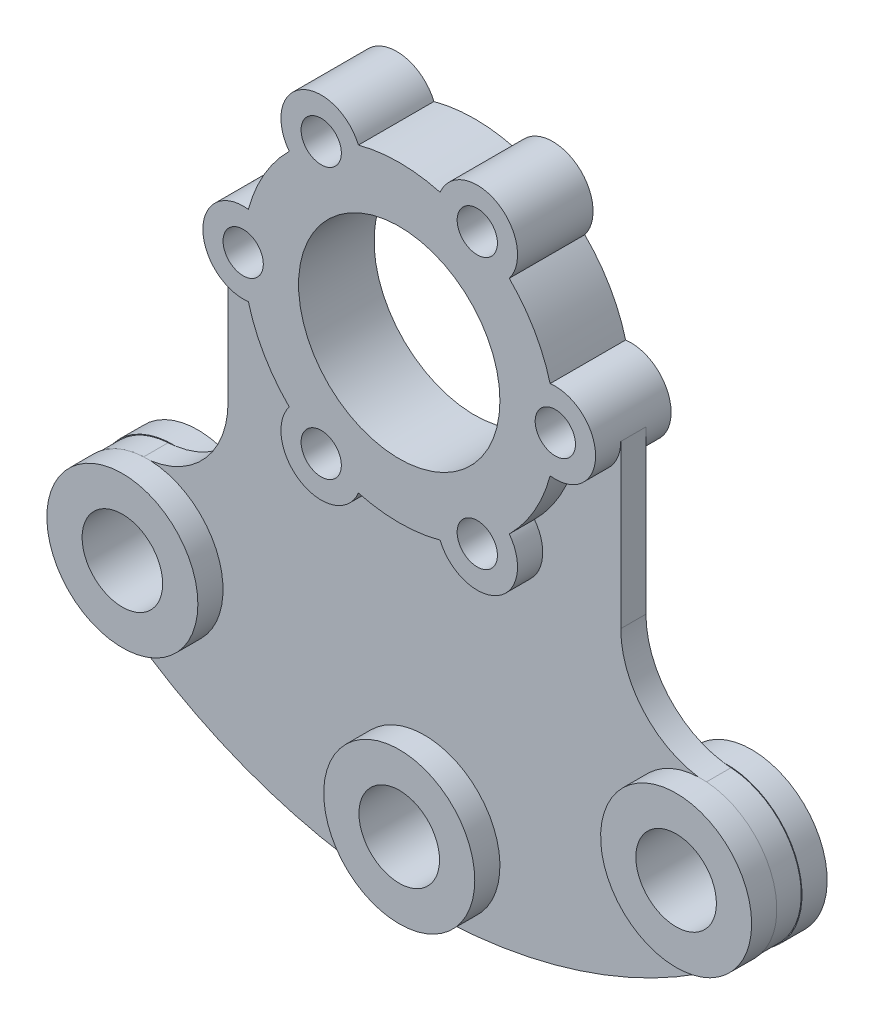
from build123d import *
from build123d.topology import SkipClean

# Parameters (mm, degrees)
SKETCH1_R           = 20
SKETCH1_R_2         = 4
BOSS_EXTRUDE1_DEPTH = 15
SKETCH3_R           = 8
BOSS_EXTRUDE2_DEPTH = 2.5
SKETCH4_R           = 15
SKETCH4_R_2         = 8
BOSS_EXTRUDE3_DEPTH = 5
BOSS_EXTRUDE4_START = 5
SKETCH5_R           = 15
SKETCH5_R_2         = 8
BOSS_EXTRUDE4_DEPTH = 5


with BuildPart() as part:
    # Sketch1 → Boss-Extrude1 (new body)
    with BuildSketch(Plane.XY):
        with BuildLine():
            ThreePointArc((-21.854157167, 21.986264223), (-26.846787517, 15.5), (-29.967741935, 7.933123174))
            ThreePointArc((-29.967741935, 7.933123174), (-39, 0), (-29.967741935, -7.933123174))
            ThreePointArc((-29.967741935, -7.933123174), (-26.846787517, -15.5), (-21.854157167, -21.986264223))
            ThreePointArc((-21.854157167, -21.986264223), (-19.5, -33.774990748), (-8.113584768, -29.919387397))
            ThreePointArc((-8.113584768, -29.919387397), (0, -31), (8.113584768, -29.919387397))
            ThreePointArc((8.113584768, -29.919387397), (19.5, -33.774990748), (21.854157167, -21.986264223))
            ThreePointArc((21.854157167, -21.986264223), (26.846787517, -15.5), (29.967741935, -7.933123174))
            ThreePointArc((29.967741935, -7.933123174), (39, 0), (29.967741935, 7.933123174))
            ThreePointArc((29.967741935, 7.933123174), (26.846787517, 15.5), (21.854157167, 21.986264223))
            ThreePointArc((21.854157167, 21.986264223), (19.5, 33.774990748), (8.113584768, 29.919387397))
            ThreePointArc((8.113584768, 29.919387397), (0, 31), (-8.113584768, 29.919387397))
            ThreePointArc((-8.113584768, 29.919387397), (-19.5, 33.774990748), (-21.854157167, 21.986264223))
        make_face()
        Circle(SKETCH1_R, mode=Mode.SUBTRACT)
        with Locations((31, 0)):
            Circle(SKETCH1_R_2, mode=Mode.SUBTRACT)
        with Locations((15.5, -26.846787517)):
            Circle(SKETCH1_R_2, mode=Mode.SUBTRACT)
        with Locations((-15.5, -26.846787517)):
            Circle(SKETCH1_R_2, mode=Mode.SUBTRACT)
        with Locations((-31, 0)):
            Circle(SKETCH1_R_2, mode=Mode.SUBTRACT)
        with Locations((-15.5, 26.846787517)):
            Circle(SKETCH1_R_2, mode=Mode.SUBTRACT)
        with Locations((15.5, 26.846787517)):
            Circle(SKETCH1_R_2, mode=Mode.SUBTRACT)
    extrude(amount=-BOSS_EXTRUDE1_DEPTH)

    # Sketch3 → Boss-Extrude2 (add, symmetric)
    with BuildSketch(Plane.XY.offset(-7.5)):
        with BuildLine():
            Line((39, -32.207865452), (39, 0))
            ThreePointArc((39, 0), (36.279296141, -6.01074307), (29.967741935, -7.933123174))
            ThreePointArc((29.967741935, -7.933123174), (26.846787517, -15.5), (21.854157167, -21.986264223))
            ThreePointArc((21.854157167, -21.986264223), (19.5, -33.774990748), (8.113584768, -29.919387397))
            ThreePointArc((8.113584768, -29.919387397), (0, -31), (-8.113584768, -29.919387397))
            ThreePointArc((-8.113584768, -29.919387397), (-19.5, -33.774990748), (-21.854157167, -21.986264223))
            ThreePointArc((-21.854157167, -21.986264223), (-26.846787517, -15.5), (-29.967741935, -7.933123174))
            ThreePointArc((-29.967741935, -7.933123174), (-36.279296141, -6.01074307), (-39, 0))
            Line((-39, 0), (-39, -32.207865452))
            ThreePointArc((-39, -32.207865452), (-43.890381677, -44.542285074), (-55.904211935, -50.174480284))
            ThreePointArc((-55.904211935, -50.174480284), (-69.095919746, -60.318260945), (-64.594224147, -76.338628537))
            ThreePointArc((-64.594224147, -76.338628537), (0, -100), (64.594224147, -76.338628537))
            ThreePointArc((64.594224147, -76.338628537), (69.095919746, -60.318260945), (55.904211935, -50.174480284))
            ThreePointArc((55.904211935, -50.174480284), (43.890381677, -44.542285074), (39, -32.207865452))
        make_face()
        with Locations((0, -85)):
            Circle(SKETCH3_R, mode=Mode.SUBTRACT)
        with Locations((55, -65)):
            Circle(SKETCH3_R, mode=Mode.SUBTRACT)
        with Locations((-55, -65)):
            Circle(SKETCH3_R, mode=Mode.SUBTRACT)
    extrude(amount=BOSS_EXTRUDE2_DEPTH, both=True)

    # Sketch4 → Boss-Extrude3 (add)
    # profile 1 of 3: a face of its own
    with BuildSketch(Plane.XY.offset(-5)):
        with Locations(Location((-55, -65, 0), (0, 0, 238.466110015))):
            Circle(SKETCH4_R)
        with Locations((-55, -65)):
            Circle(SKETCH4_R_2, mode=Mode.SUBTRACT)
    # profile 2 of 3: a face of its own
    with BuildSketch(Plane.XY.offset(-5)):
        with Locations(Location((0, -85, 0), (0, 0, 269.999773035))):
            Circle(SKETCH4_R)
        with Locations((0, -85)):
            Circle(SKETCH4_R_2, mode=Mode.SUBTRACT)
    # profile 3 of 3: a face of its own
    with BuildSketch(Plane.XY.offset(-5)):
        with Locations(Location((55, -65, 0), (0, 0, 92.436415058))):
            Circle(SKETCH4_R)
        with Locations((55, -65)):
            Circle(SKETCH4_R_2, mode=Mode.SUBTRACT)
    extrude(amount=BOSS_EXTRUDE3_DEPTH)

    # Sketch5 → Boss-Extrude4 (add)
    # profile 1 of 3: a face of its own
    with SkipClean():  # the faces are left unmerged after this step: merging them gives an invalid solid
        with BuildSketch(Plane(origin=(0, 0, -10), x_dir=(-1, 0, 0), z_dir=(0, 0, -1)).offset(BOSS_EXTRUDE4_START)):
            with Locations(Location((-55, -65, 0), (0, 0, 87.563584942))):
                Circle(SKETCH5_R)
            with Locations((-55, -65)):
                Circle(SKETCH5_R_2, mode=Mode.SUBTRACT)
        # profile 2 of 3: a face of its own
        with BuildSketch(Plane(origin=(0, 0, -10), x_dir=(-1, 0, 0), z_dir=(0, 0, -1)).offset(BOSS_EXTRUDE4_START)):
            with Locations(Location((0, -85, 0), (0, 0, 270.000226965))):
                Circle(SKETCH5_R)
            with Locations((0, -85)):
                Circle(SKETCH5_R_2, mode=Mode.SUBTRACT)
        # profile 3 of 3: a face of its own
        with BuildSketch(Plane(origin=(0, 0, -10), x_dir=(-1, 0, 0), z_dir=(0, 0, -1)).offset(BOSS_EXTRUDE4_START)):
            with Locations(Location((55, -65, 0), (0, 0, 301.533889985))):
                Circle(SKETCH5_R)
            with Locations((55, -65)):
                Circle(SKETCH5_R_2, mode=Mode.SUBTRACT)
        extrude(amount=-BOSS_EXTRUDE4_DEPTH)


solid = part.part
